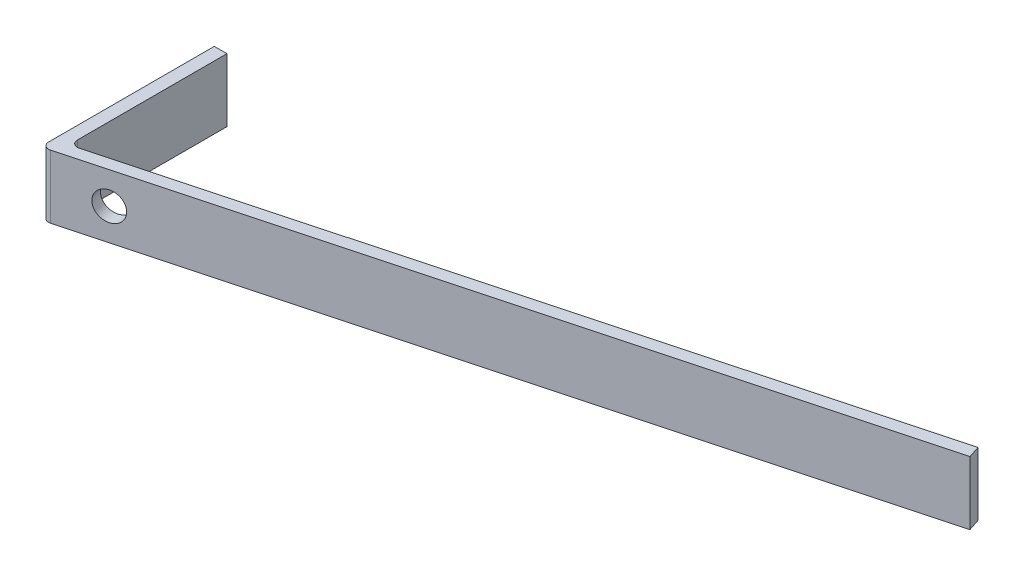
from build123d import *

# Parameters (mm, degrees)
BOSS_EXTRUDE1_DEPTH = 10
BOSS_EXTRUDE2_DEPTH = 10
FILLET1_R           = 1
SKETCH4_R           = 2.25
CUT_EXTRUDE1_DEPTH  = 10


with BuildPart() as part:
    # Sketch1 → Boss-Extrude1 (new body)
    with BuildSketch(Plane(origin=(0, 0, 0), x_dir=(1, 0, 0), z_dir=(0, 1, 0))):
        Polygon((0, 0), (2, 0.535898385), (2, 27.5), (0, 27.5), align=None)
    extrude(amount=BOSS_EXTRUDE1_DEPTH)

    # Sketch3 → Boss-Extrude2 (add)
    with BuildSketch(Plane.XZ):
        Polygon((0, 0), (115.911099155, -31.058285412), (115.285791267, -32.958019616), (0, -2), align=None)
    extrude(amount=-BOSS_EXTRUDE2_DEPTH)

    # Fillet1
    fillet1_edges = [part.edges().sort_by_distance(p)[0] for p in [
        (2, 5, -2.537065657),
        (0, 5, 0),
    ]]
    fillet(fillet1_edges, radius=FILLET1_R)

    # Sketch4 → Cut-Extrude1 (cut)
    with BuildSketch(Plane(origin=(-0.500942736, 0, -1.86548043), x_dir=(-0.9657847664118184, 0, 0.25934491505882573), z_dir=(-0.25934491505882573, 0, -0.9657847664118184))):
        with Locations((-8.893504829, 5)):
            Circle(SKETCH4_R)
    extrude(amount=-CUT_EXTRUDE1_DEPTH, mode=Mode.SUBTRACT)


solid = part.part
